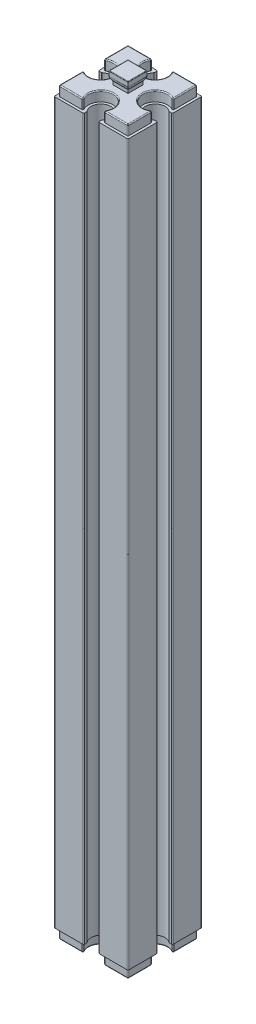
from build123d import *

# Parameters (mm, degrees)
EXTRUDE_1_DEPTH        = 73
EXTRUDE_2_DEPTH        = 2
EXTRUDE_3_DEPTH        = 2
FILLET_3_R             = 0.2
CUT_EXTRUDE_1_DEPTH    = 3
FILLET_4_R             = 0.2
FILLET_5_R             = 0.1
FILLET_3_OF_MIRROR_1_R = 0.2
FILLET_4_OF_MIRROR_1_R = 0.2
FILLET_5_OF_MIRROR_1_R = 0.1


with BuildPart() as part:
    # 草图1 → 凸台-拉伸1 (new body)
    with BuildSketch(Plane(origin=(0, 0, 0), x_dir=(1, 0, 0), z_dir=(0, 1, 0))):
        with BuildLine():
            Line((-7.5, 7.5), (-1.5, 7.5))
            Line((-1.5, 7.5), (-1.5, 6.822875656))
            ThreePointArc((-1.5, 6.822875656), (0, 3.5), (1.5, 6.822875656))
            Line((1.5, 6.822875656), (1.5, 7.5))
            Line((1.5, 7.5), (7.5, 7.5))
            Line((7.5, 7.5), (7.5, 1.5))
            Line((7.5, 1.5), (6.822875656, 1.5))
            ThreePointArc((6.822875656, 1.5), (3.5, 0), (6.822875656, -1.5))
            Line((6.822875656, -1.5), (7.5, -1.5))
            Line((7.5, -1.5), (7.5, -7.5))
            Line((7.5, -7.5), (1.5, -7.5))
            Line((1.5, -7.5), (1.5, -6.822875656))
            ThreePointArc((1.5, -6.822875656), (0, -3.5), (-1.5, -6.822875656))
            Line((-1.5, -6.822875656), (-1.5, -7.5))
            Line((-1.5, -7.5), (-7.5, -7.5))
            Line((-7.5, -7.5), (-7.5, -1.5))
            Line((-7.5, -1.5), (-6.822875656, -1.5))
            ThreePointArc((-6.822875656, -1.5), (-3.5, 0), (-6.822875656, 1.5))
            Line((-6.822875656, 1.5), (-7.5, 1.5))
            Line((-7.5, 1.5), (-7.5, 7.5))
        make_face()
    extrude_1 = extrude(amount=EXTRUDE_1_DEPTH)

    # 草图2 → 凸台-拉伸2 (add)
    with BuildSketch(Plane(origin=(0, 73, 0), x_dir=(1, 0, 0), z_dir=(0, 1, 0))):
        with BuildLine():
            Line((-7, 7), (-7, 2))
            ThreePointArc((-7, 2), (-3, 0), (-7, -2))
            Line((-7, -2), (-7, -7))
            Line((-7, -7), (-2, -7))
            ThreePointArc((-2, -7), (0, -3), (2, -7))
            Line((2, -7), (7, -7))
            Line((7, -7), (7, -2))
            ThreePointArc((7, -2), (3, 0), (7, 2))
            Line((7, 2), (7, 7))
            Line((7, 7), (2, 7))
            ThreePointArc((2, 7), (0, 3), (-2, 7))
            Line((-2, 7), (-7, 7))
        make_face()
    extrude_2 = extrude(amount=EXTRUDE_2_DEPTH)

    # 草图3 → 凸台-拉伸3 (add, symmetric)
    with BuildSketch(Plane(origin=(0, 0, 0), x_dir=(0, 0, -1), z_dir=(1, 0, 0))):
        with BuildLine():
            Line((-1.5, 75), (1.5, 75))
            Line((1.5, 75), (1.5, 75.677124344))
            ThreePointArc((1.5, 75.677124344), (1.780042303, 76.088161527), (1.95, 76.555590279))
            Line((1.95, 76.555590279), (1.95, 77.5))
            Line((1.95, 77.5), (-1.95, 77.5))
            Line((-1.95, 77.5), (-1.95, 76.555590279))
            ThreePointArc((-1.95, 76.555590279), (-1.780042303, 76.088161527), (-1.5, 75.677124344))
            Line((-1.5, 75.677124344), (-1.5, 75))
        make_face()
    extrude_3 = extrude(amount=EXTRUDE_3_DEPTH, both=True)

    # 圆角3
    fillet_3_edges = [part.edges().sort_by_distance(p)[0] for p in [
        (-7.5, 36.5, -7.5),
        (-1.5, 36.5, -7.5),
        (1.5, 36.5, -7.5),
        (7.5, 36.5, -7.5),
        (7.5, 36.5, -1.5),
        (7.5, 36.5, 1.5),
        (7.5, 36.5, 7.5),
        (1.5, 36.5, 7.5),
        (-1.5, 36.5, 7.5),
        (-7.5, 36.5, 7.5),
        (-7.5, 36.5, 1.5),
        (-6.822875656, 36.5, -1.5),
        (-7.5, 36.5, -1.5),
    ]]
    fillet(fillet_3_edges, radius=FILLET_3_R)

    # 草图4 → 切除-拉伸1 (cut, symmetric)
    with BuildSketch(Plane.XY):
        with BuildLine():
            Line((1.95, 77.5), (2, 77.5))
            Line((2, 77.5), (2, 75))
            Line((2, 75), (1.5, 75))
            Line((1.5, 75), (1.5, 75.677124344))
            ThreePointArc((1.5, 75.677124344), (1.780042303, 76.088161527), (1.95, 76.555590279))
            Line((1.95, 76.555590279), (1.95, 77.5))
        make_face()
        with BuildLine():
            Line((-1.95, 77.5), (-1.95, 76.555590279))
            ThreePointArc((-1.95, 76.555590279), (-1.780042303, 76.088161527), (-1.5, 75.677124344))
            Line((-1.5, 75.677124344), (-1.5, 75))
            Line((-1.5, 75), (-2, 75))
            Line((-2, 75), (-2, 77.5))
            Line((-2, 77.5), (-1.95, 77.5))
        make_face()
    cut_extrude_1 = extrude(amount=CUT_EXTRUDE_1_DEPTH, both=True, mode=Mode.SUBTRACT)

    # 圆角4
    fillet_4_edges = [part.edges().sort_by_distance(p)[0] for p in [
        (-2, 74, -7),
        (-7, 74, -7),
        (-7, 74, -2),
        (-7, 74, 2),
        (-7, 74, 7),
        (-2, 74, 7),
        (2, 74, 7),
        (7, 74, 7),
        (7, 74, 2),
        (7, 74, -2),
        (7, 74, -7),
        (2, 74, -7),
        (-4.5, 75, -7),
        (-7, 75, -4.5),
        (-3, 75, 0),
        (-7, 75, 4.5),
        (-4.5, 75, 7),
        (0, 75, 3),
        (4.5, 75, 7),
        (7, 75, 4.5),
        (3, 75, 0),
        (7, 75, -4.5),
        (4.5, 75, -7),
        (0, 75, -3),
    ]]
    fillet(fillet_4_edges, radius=FILLET_4_R)

    # 圆角5
    fillet_5_edges = [part.edges().sort_by_distance(p)[0] for p in [
        (1.95, 77.5, 0),
        (0, 77.5, -1.95),
        (0, 77.5, 1.95),
        (-1.95, 77.5, 0),
    ]]
    fillet(fillet_5_edges, radius=FILLET_5_R)


with BuildPart() as mirror_1_1:
    # 镜向1: 凸台-拉伸1, 凸台-拉伸2, 凸台-拉伸3 across Top Plane
    add(extrude_1.mirror(Plane(origin=(0, 0, 0), x_dir=(1, 0, 0), z_dir=(0, 1, 0))))
    add(extrude_2.mirror(Plane(origin=(0, 0, 0), x_dir=(1, 0, 0), z_dir=(0, 1, 0))))
    add(extrude_3.mirror(Plane(origin=(0, 0, 0), x_dir=(1, 0, 0), z_dir=(0, 1, 0))))

    # Mirror 1 2: 切除-拉伸1 across Top Plane
    add(cut_extrude_1.mirror(Plane(origin=(0, 0, 0), x_dir=(1, 0, 0), z_dir=(0, 1, 0))), mode=Mode.SUBTRACT)

    # 圆角3 of 镜向1
    fillet_3_of_mirror_1_edges = [mirror_1_1.edges().sort_by_distance(p)[0] for p in [
        (-7.5, -36.5, -7.5),
        (-1.5, -36.5, -7.5),
        (1.5, -36.5, -7.5),
        (7.5, -36.5, -7.5),
        (7.5, -36.5, -1.5),
        (7.5, -36.5, 1.5),
        (7.5, -36.5, 7.5),
        (1.5, -36.5, 7.5),
        (-1.5, -36.5, 7.5),
        (-7.5, -36.5, 7.5),
        (-7.5, -36.5, 1.5),
        (-6.822875656, -36.5, -1.5),
        (-7.5, -36.5, -1.5),
    ]]
    fillet(fillet_3_of_mirror_1_edges, radius=FILLET_3_OF_MIRROR_1_R)

    # 圆角4 of 镜向1
    fillet_4_of_mirror_1_edges = [mirror_1_1.edges().sort_by_distance(p)[0] for p in [
        (-2, -74, -7),
        (-7, -74, -7),
        (-7, -74, -2),
        (-7, -74, 2),
        (-7, -74, 7),
        (-2, -74, 7),
        (2, -74, 7),
        (7, -74, 7),
        (7, -74, 2),
        (7, -74, -2),
        (7, -74, -7),
        (2, -74, -7),
        (-4.5, -75, -7),
        (-7, -75, -4.5),
        (-3, -75, 0),
        (-7, -75, 4.5),
        (-4.5, -75, 7),
        (0, -75, 3),
        (4.5, -75, 7),
        (7, -75, 4.5),
        (3, -75, 0),
        (7, -75, -4.5),
        (4.5, -75, -7),
        (0, -75, -3),
    ]]
    fillet(fillet_4_of_mirror_1_edges, radius=FILLET_4_OF_MIRROR_1_R)

    # 圆角5 of 镜向1
    fillet_5_of_mirror_1_edges = [mirror_1_1.edges().sort_by_distance(p)[0] for p in [
        (1.95, -77.5, 0),
        (0, -77.5, -1.95),
        (0, -77.5, 1.95),
        (-1.95, -77.5, 0),
    ]]
    fillet(fillet_5_of_mirror_1_edges, radius=FILLET_5_OF_MIRROR_1_R)


with BuildPart() as part_1:
    add(part.part)

    # 镜向1 united with what the copies tou: union 镜向1_1
    add(mirror_1_1.part)


solid = part_1.part
